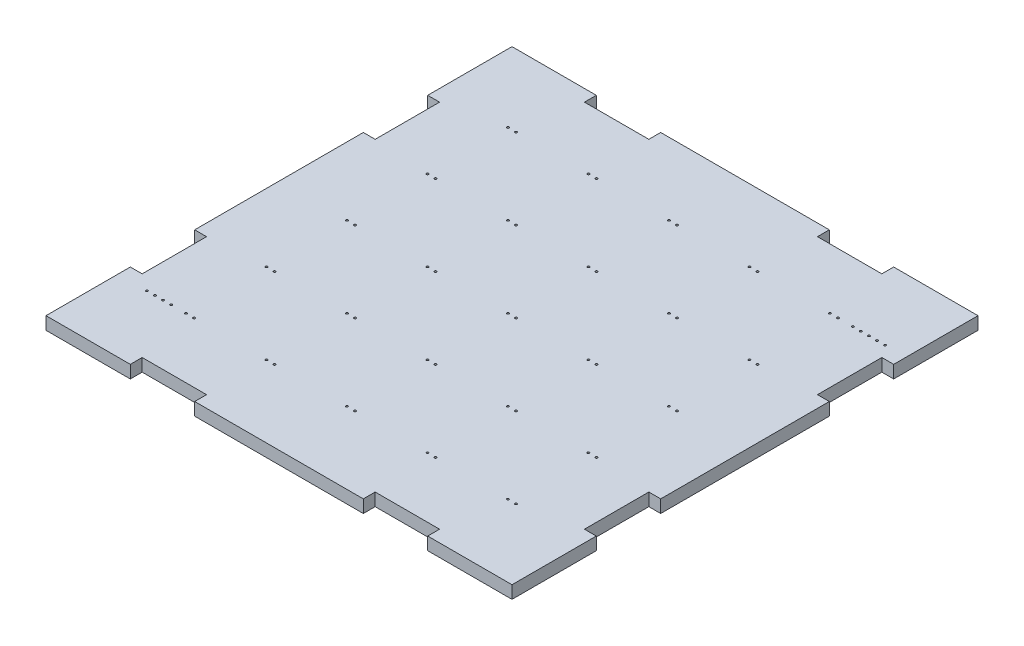
from build123d import *

# Parameters (mm, degrees)
SKETCH2_W           = 220
SKETCH2_H           = 220
BOSS_EXTRUDE1_DEPTH = 6
SKETCH3_R           = 0.5
CUT_EXTRUDE1_DEPTH  = 156.679157243
SKETCH4_R           = 0.5
CUT_EXTRUDE2_DEPTH  = 156.679157243
SKETCH5_W           = 30.4
SKETCH5_H           = 5.6
SKETCH5_W_2         = 5.6
SKETCH5_H_2         = 30.4
CUT_EXTRUDE3_DEPTH  = 156.679157243


with BuildPart() as part:
    # Sketch2 → Boss-Extrude1 (new body)
    with BuildSketch(Plane(origin=(0, 0, 0), x_dir=(1, 0, 0), z_dir=(0, 1, 0))):
        Rectangle(SKETCH2_W, SKETCH2_H)
    extrude(amount=BOSS_EXTRUDE1_DEPTH)

    # Sketch3 → Cut-Extrude1 (cut, through all)
    with BuildSketch(Plane(origin=(0, 6, 0), x_dir=(1, 0, 0), z_dir=(0, 1, 0))):
        with Locations(Location((-77.905, -76, 0), (0, 0, 270))):
            Circle(SKETCH3_R)
        with Locations(Location((-74.095, -76, 0), (0, 0, 270))):
            Circle(SKETCH3_R)
        with Locations(Location((-39.905, -76, 0), (0, 0, 270))):
            Circle(SKETCH3_R)
        with Locations(Location((-36.095, -76, 0), (0, 0, 270))):
            Circle(SKETCH3_R)
        with Locations(Location((-1.905, -76, 0), (0, 0, 270))):
            Circle(SKETCH3_R)
        with Locations(Location((1.905, -76, 0), (0, 0, 270))):
            Circle(SKETCH3_R)
        with Locations(Location((36.095, -76, 0), (0, 0, 270))):
            Circle(SKETCH3_R)
        with Locations(Location((39.905, -76, 0), (0, 0, 270))):
            Circle(SKETCH3_R)
        with Locations(Location((74.095, -76, 0), (0, 0, 270))):
            Circle(SKETCH3_R)
        with Locations(Location((77.905, -76, 0), (0, 0, 270))):
            Circle(SKETCH3_R)
        with Locations(Location((-39.905, -38, 0), (0, 0, 270))):
            Circle(SKETCH3_R)
        with Locations(Location((-36.095, -38, 0), (0, 0, 270))):
            Circle(SKETCH3_R)
        with Locations(Location((-1.905, -38, 0), (0, 0, 270))):
            Circle(SKETCH3_R)
        with Locations(Location((1.905, -38, 0), (0, 0, 270))):
            Circle(SKETCH3_R)
        with Locations(Location((36.095, -38, 0), (0, 0, 270))):
            Circle(SKETCH3_R)
        with Locations(Location((39.905, -38, 0), (0, 0, 270))):
            Circle(SKETCH3_R)
        with Locations(Location((74.095, -38, 0), (0, 0, 270))):
            Circle(SKETCH3_R)
        with Locations(Location((77.905, -38, 0), (0, 0, 270))):
            Circle(SKETCH3_R)
        with Locations(Location((-39.905, 0, 0), (0, 0, 270))):
            Circle(SKETCH3_R)
        with Locations(Location((-36.095, 0, 0), (0, 0, 270))):
            Circle(SKETCH3_R)
        with Locations(Location((-1.905, 0, 0), (0, 0, 270))):
            Circle(SKETCH3_R)
        with Locations(Location((1.905, 0, 0), (0, 0, 270))):
            Circle(SKETCH3_R)
        with Locations(Location((36.095, 0, 0), (0, 0, 270))):
            Circle(SKETCH3_R)
        with Locations(Location((39.905, 0, 0), (0, 0, 270))):
            Circle(SKETCH3_R)
        with Locations(Location((74.095, 0, 0), (0, 0, 270))):
            Circle(SKETCH3_R)
        with Locations(Location((77.905, 0, 0), (0, 0, 270))):
            Circle(SKETCH3_R)
        with Locations(Location((-39.905, 38, 0), (0, 0, 270))):
            Circle(SKETCH3_R)
        with Locations(Location((-36.095, 38, 0), (0, 0, 270))):
            Circle(SKETCH3_R)
        with Locations(Location((-1.905, 38, 0), (0, 0, 270))):
            Circle(SKETCH3_R)
        with Locations(Location((1.905, 38, 0), (0, 0, 270))):
            Circle(SKETCH3_R)
        with Locations(Location((36.095, 38, 0), (0, 0, 270))):
            Circle(SKETCH3_R)
        with Locations(Location((39.905, 38, 0), (0, 0, 270))):
            Circle(SKETCH3_R)
        with Locations(Location((74.095, 38, 0), (0, 0, 270))):
            Circle(SKETCH3_R)
        with Locations(Location((77.905, 38, 0), (0, 0, 270))):
            Circle(SKETCH3_R)
        with Locations(Location((-39.905, 76, 0), (0, 0, 270))):
            Circle(SKETCH3_R)
        with Locations(Location((-36.095, 76, 0), (0, 0, 270))):
            Circle(SKETCH3_R)
        with Locations(Location((-1.905, 76, 0), (0, 0, 270))):
            Circle(SKETCH3_R)
        with Locations(Location((1.905, 76, 0), (0, 0, 270))):
            Circle(SKETCH3_R)
        with Locations(Location((36.095, 76, 0), (0, 0, 270))):
            Circle(SKETCH3_R)
        with Locations(Location((39.905, 76, 0), (0, 0, 270))):
            Circle(SKETCH3_R)
        with Locations(Location((74.095, 76, 0), (0, 0, 270))):
            Circle(SKETCH3_R)
        with Locations(Location((77.905, 76, 0), (0, 0, 270))):
            Circle(SKETCH3_R)
        with Locations(Location((-77.905, -38, 0), (0, 0, 270))):
            Circle(SKETCH3_R)
        with Locations(Location((-74.095, -38, 0), (0, 0, 270))):
            Circle(SKETCH3_R)
        with Locations(Location((-77.905, 0, 0), (0, 0, 270))):
            Circle(SKETCH3_R)
        with Locations(Location((-74.095, 0, 0), (0, 0, 270))):
            Circle(SKETCH3_R)
        with Locations(Location((-77.905, 38, 0), (0, 0, 270))):
            Circle(SKETCH3_R)
        with Locations(Location((-74.095, 38, 0), (0, 0, 270))):
            Circle(SKETCH3_R)
        with Locations(Location((-77.905, 76, 0), (0, 0, 270))):
            Circle(SKETCH3_R)
        with Locations(Location((-74.095, 76, 0), (0, 0, 270))):
            Circle(SKETCH3_R)
    extrude(amount=-CUT_EXTRUDE1_DEPTH, mode=Mode.SUBTRACT)

    # Sketch4 → Cut-Extrude2 (cut, through all)
    with BuildSketch(Plane(origin=(0, 6, 0), x_dir=(1, 0, 0), z_dir=(0, 1, 0))):
        with Locations(Location((84.905, 76, 0), (0, 0, 270))):
            Circle(SKETCH4_R)
        with Locations(Location((88.715, 76, 0), (0, 0, 270))):
            Circle(SKETCH4_R)
        with Locations(Location((92.525, 76, 0), (0, 0, 270))):
            Circle(SKETCH4_R)
        with Locations(Location((96.335, 76, 0), (0, 0, 270))):
            Circle(SKETCH4_R)
        with Locations(Location((100.145, 76, 0), (0, 0, 270))):
            Circle(SKETCH4_R)
        with Locations(Location((-84.905, -76, 0), (0, 0, 270))):
            Circle(SKETCH4_R)
        with Locations(Location((-88.715, -76, 0), (0, 0, 270))):
            Circle(SKETCH4_R)
        with Locations(Location((-92.525, -76, 0), (0, 0, 270))):
            Circle(SKETCH4_R)
        with Locations(Location((-96.335, -76, 0), (0, 0, 270))):
            Circle(SKETCH4_R)
    extrude(amount=-CUT_EXTRUDE2_DEPTH, mode=Mode.SUBTRACT)

    # Sketch5 → Cut-Extrude3 (cut, through all)
    with BuildSketch(Plane(origin=(0, 6, 0), x_dir=(1, 0, 0), z_dir=(0, 1, 0))):
        with Locations((-55, 107.2)):
            Rectangle(SKETCH5_W, SKETCH5_H)
        with Locations((-107.2, -55)):
            Rectangle(SKETCH5_W_2, SKETCH5_H_2)
        with Locations((55, 107.2)):
            Rectangle(SKETCH5_W, SKETCH5_H)
        with Locations((55, -107.2)):
            Rectangle(SKETCH5_W, SKETCH5_H)
        with Locations((-55, -107.2)):
            Rectangle(SKETCH5_W, SKETCH5_H)
        with Locations((-107.2, 55)):
            Rectangle(SKETCH5_W_2, SKETCH5_H_2)
        with Locations((107.2, -55)):
            Rectangle(SKETCH5_W_2, SKETCH5_H_2)
        with Locations((107.2, 55)):
            Rectangle(SKETCH5_W_2, SKETCH5_H_2)
    extrude(amount=-CUT_EXTRUDE3_DEPTH, mode=Mode.SUBTRACT)


solid = part.part
